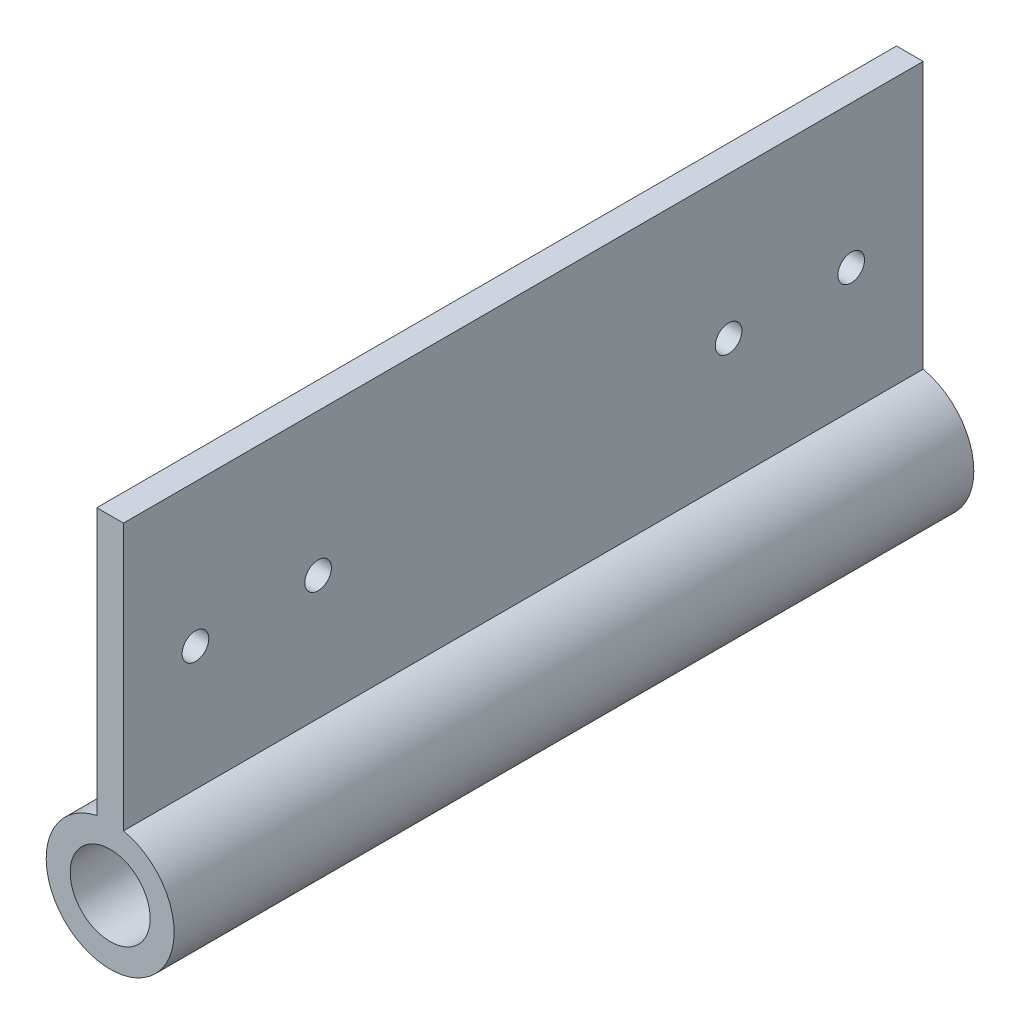
from build123d import *

# Parameters (mm, degrees)
SKETCH1_R           = 7.5
BOSS_EXTRUDE1_DEPTH = 150
SKETCH3_R           = 2.5
CUT_EXTRUDE2_DEPTH  = 163.854749576


with BuildPart() as part:
    # Sketch1 → Boss-Extrude1 (new body)
    with BuildSketch(Plane.XY):
        with BuildLine():
            Line((-2.5, 61.736694594), (-2.5, 11.736694594))
            ThreePointArc((-2.5, 11.736694594), (0, -12), (2.5, 11.736694594))
            Line((2.5, 11.736694594), (2.5, 61.736694594))
            Line((2.5, 61.736694594), (-2.5, 61.736694594))
        make_face()
        Circle(SKETCH1_R, mode=Mode.SUBTRACT)
    extrude(amount=BOSS_EXTRUDE1_DEPTH)

    # Sketch3 → Cut-Extrude2 (cut, through all)
    with BuildSketch(Plane.ZY.offset(2.5)):
        with Locations(Location((113.5, 35, 0), (0, 0, 270))):
            Circle(SKETCH3_R)
        with Locations(Location((136.5, 35, 0), (0, 0, 270))):
            Circle(SKETCH3_R)
        with Locations(Location((36.5, 35, 0), (0, 0, 270))):
            Circle(SKETCH3_R)
        with Locations(Location((13.5, 35, 0), (0, 0, 270))):
            Circle(SKETCH3_R)
    extrude(amount=-CUT_EXTRUDE2_DEPTH, mode=Mode.SUBTRACT)


solid = part.part
